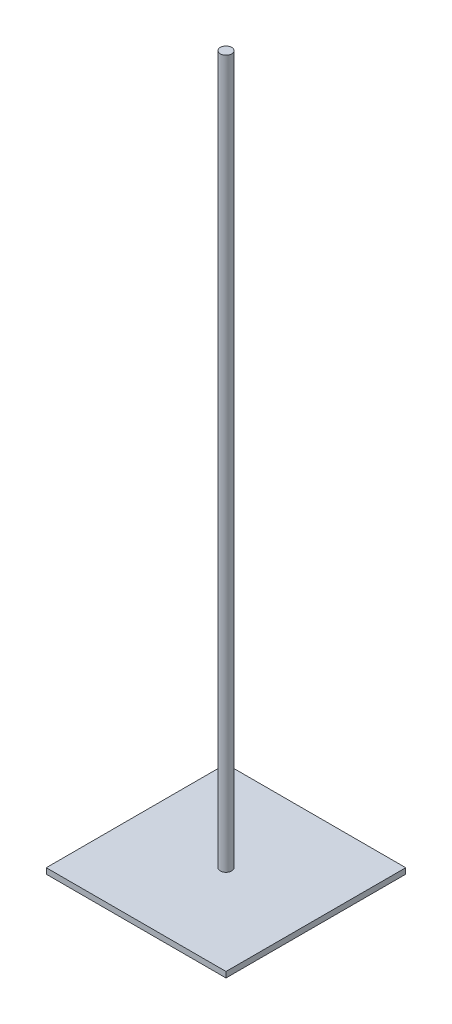
from build123d import *

# Parameters (mm, degrees)
SKETCH1_W           = 127
SKETCH1_H           = 127
BOSS_EXTRUDE1_DEPTH = 4
SKETCH2_R           = 4
BOSS_EXTRUDE2_DEPTH = 500


with BuildPart() as part:
    # Sketch1 → Boss-Extrude1 (new body)
    with BuildSketch(Plane(origin=(0, 0, 0), x_dir=(1, 0, 0), z_dir=(0, 1, 0))):
        with Locations((-63.5, -63.5)):
            Rectangle(SKETCH1_W, SKETCH1_H)
    extrude(amount=BOSS_EXTRUDE1_DEPTH)


with BuildPart() as body_2:
    # Sketch2 → Boss-Extrude2 (new body)
    with BuildSketch(Plane(origin=(0, 4, 0), x_dir=(1, 0, 0), z_dir=(0, 1, 0))):
        with Locations(Location((-63.5, -63.5, 0), (0, 0, 270))):
            Circle(SKETCH2_R)
    extrude(amount=BOSS_EXTRUDE2_DEPTH)


solid = Compound([part.part, body_2.part])
